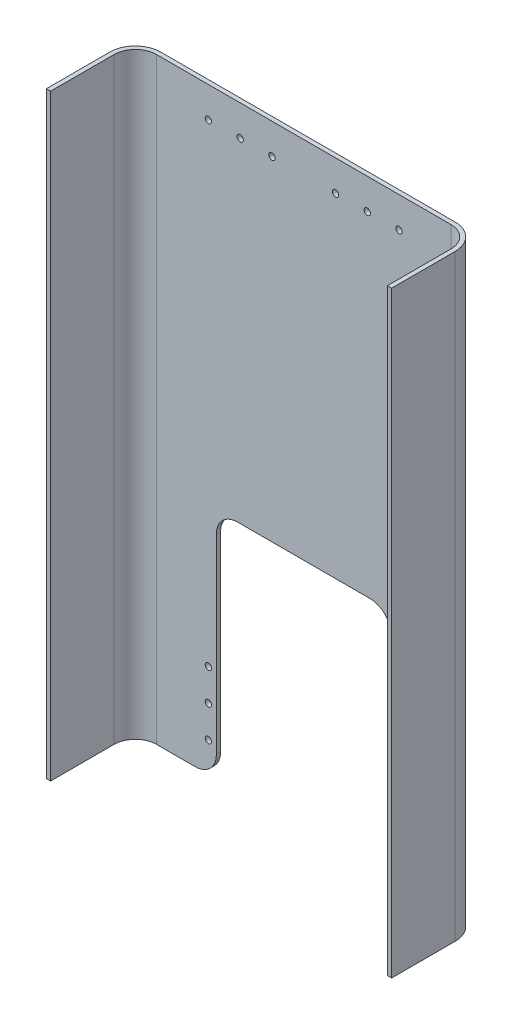
from build123d import *

# Parameters (mm, degrees)
EXTRUDE_THIN1_DEPTH     = 564
CUT_EXTRUDE2_DEPTH      = 594.060705156
CUT_EXTRUDE2_DEPTH_BACK = 594.060705156
SKETCH3_W               = 165
SKETCH3_H               = 220
FILLET1_R               = 20
SKETCH4_R               = 3
CUT_EXTRUDE3_DEPTH      = 594.060705156


with BuildPart() as part:
    # Sketch1 → Extrude-Thin1 (new body)
    with BuildSketch(Plane(origin=(0, 0, 0), x_dir=(1, 0, 0), z_dir=(0, 1, 0))):
        with BuildLine():
            Line((-159, -80), (-159, -20))
            ThreePointArc((-159, -20), (-153.142135624, -5.857864376), (-139, 0))
            Line((-139, 0), (139, 0))
            ThreePointArc((139, 0), (153.142135624, -5.857864376), (159, -20))
            Line((159, -20), (159, -80))
            Line((159, -80), (163, -80))
            Line((163, -80), (163, -20))
            ThreePointArc((163, -20), (155.970562748, -3.029437252), (139, 4))
            Line((139, 4), (-139, 4))
            ThreePointArc((-139, 4), (-155.970562748, -3.029437252), (-163, -20))
            Line((-163, -20), (-163, -80))
            Line((-163, -80), (-159, -80))
        make_face()
    extrude(amount=EXTRUDE_THIN1_DEPTH)

    # Sketch3 → Cut-Extrude2 (cut, two sides: drawn at the far end of the back side and taken through both)
    with BuildSketch(Plane(origin=(0, 0, -4), x_dir=(-1, 0, 0), z_dir=(0, 0, -1)).offset(-CUT_EXTRUDE2_DEPTH_BACK)):
        with Locations((0, 110)):
            Rectangle(SKETCH3_W, SKETCH3_H)
    extrude(amount=CUT_EXTRUDE2_DEPTH + CUT_EXTRUDE2_DEPTH_BACK, mode=Mode.SUBTRACT)

    # Fillet1
    fillet1_edges = [part.edges().sort_by_distance(p)[0] for p in [
        (-82.5, 0, -2),
        (82.5, 0, -2),
        (82.5, 220, -2),
        (-82.5, 220, -2),
    ]]
    fillet(fillet1_edges, radius=FILLET1_R)

    # Sketch4 → Cut-Extrude3 (cut, through all)
    with BuildSketch(Plane(origin=(0, 0, -4), x_dir=(-1, 0, 0), z_dir=(0, 0, -1))):
        with Locations((-90, 535)):
            Circle(SKETCH4_R)
        with Locations((-60, 535)):
            Circle(SKETCH4_R)
        with Locations((-30, 535)):
            Circle(SKETCH4_R)
        with Locations((-90, 88.126)):
            Circle(SKETCH4_R)
        with Locations((-90, 58.126)):
            Circle(SKETCH4_R)
        with Locations((-90, 28.126)):
            Circle(SKETCH4_R)
    cut_extrude3 = extrude(amount=-CUT_EXTRUDE3_DEPTH, mode=Mode.SUBTRACT)

    # Mirror1: Cut-Extrude3 across plane
    add(cut_extrude3.mirror(Plane(origin=(0, 0, 0), x_dir=(0, 0, 1), z_dir=(1, 0, 0))), mode=Mode.SUBTRACT)


solid = part.part
